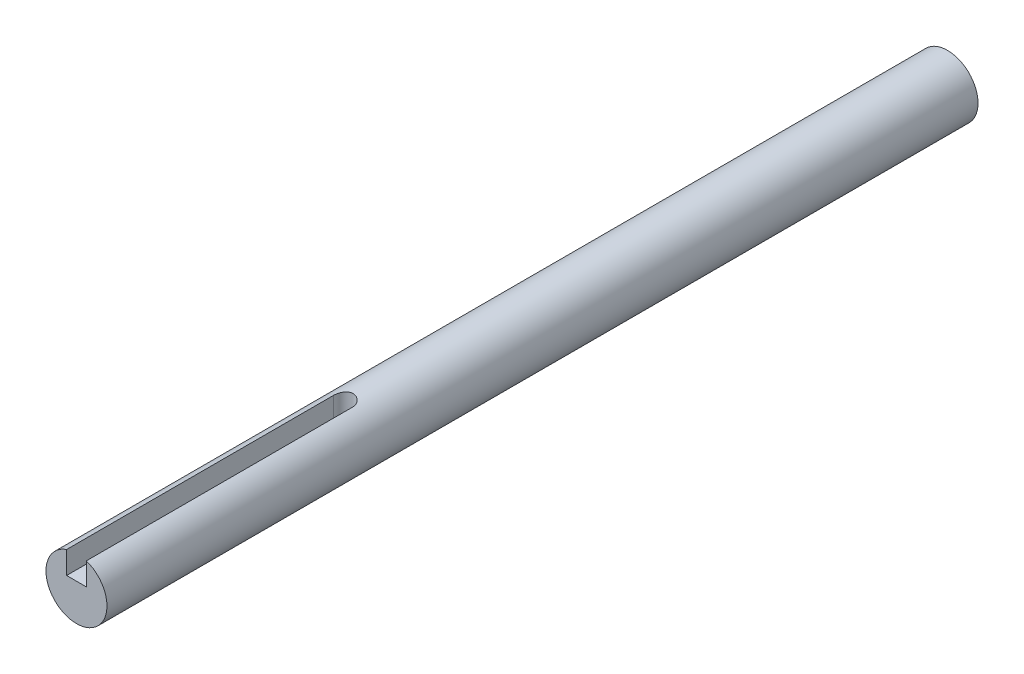
from build123d import *

# Parameters (mm, degrees)
SKETCH1_R           = 4
BOSS_EXTRUDE1_DEPTH = 114.3
BOSS_EXTRUDE2_DEPTH = 35
CUT_EXTRUDE1_DEPTH  = 5.596433308


with BuildPart() as part:
    # Sketch1 → Boss-Extrude1 (new body)
    with BuildSketch(Plane.XY):
        Circle(SKETCH1_R)
    extrude(amount=BOSS_EXTRUDE1_DEPTH)

    # Sketch2 → Boss-Extrude2 (add)
    with BuildSketch(Plane.XY.offset(114.3)):
        Polygon((-1.2954, 3.421433318), (-1.2954, 6.421433318), (1.2954, 6.421433318), (1.2954, 3.421433318), (1.2954, 0.825), (0, 0.825), (-1.2954, 0.825), align=None)
    extrude(amount=-BOSS_EXTRUDE2_DEPTH)

    # Sketch3 → Cut-Extrude1 (cut)
    with BuildSketch(Plane(origin=(0, 6.421433318, 0), x_dir=(1, 0, 0), z_dir=(0, 1, 0))):
        with BuildLine():
            Line((-1.2954, -79.3), (-1.2954, -114.3))
            Line((-1.2954, -114.3), (1.2954, -114.3))
            Line((1.2954, -114.3), (1.2954, -79.3))
            ThreePointArc((1.2954, -79.3), (0, -78.0046), (-1.2954, -79.3))
        make_face()
    extrude(amount=-CUT_EXTRUDE1_DEPTH, mode=Mode.SUBTRACT)


solid = part.part
